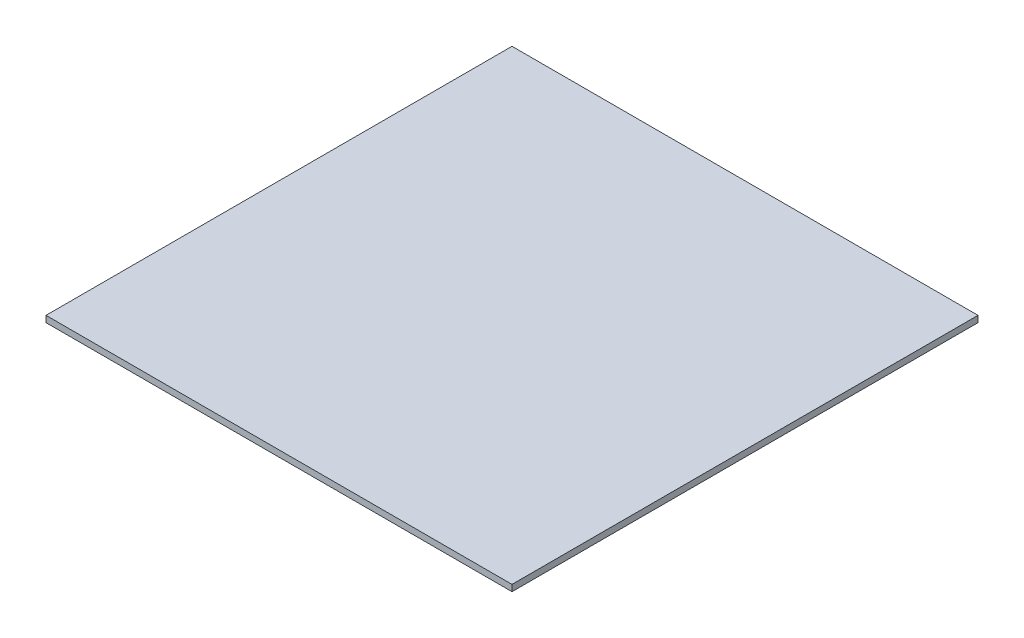
from build123d import *

# Parameters (mm, degrees)
SKETCH2_W           = 22
SKETCH2_H           = 22
BOSS_EXTRUDE1_DEPTH = 0.3


with BuildPart() as part:
    # Sketch2 → Boss-Extrude1 (new body)
    with BuildSketch(Plane(origin=(0, 0, 0), x_dir=(1, 0, 0), z_dir=(0, 1, 0))):
        Rectangle(SKETCH2_W, SKETCH2_H)
    extrude(amount=BOSS_EXTRUDE1_DEPTH)


solid = part.part
